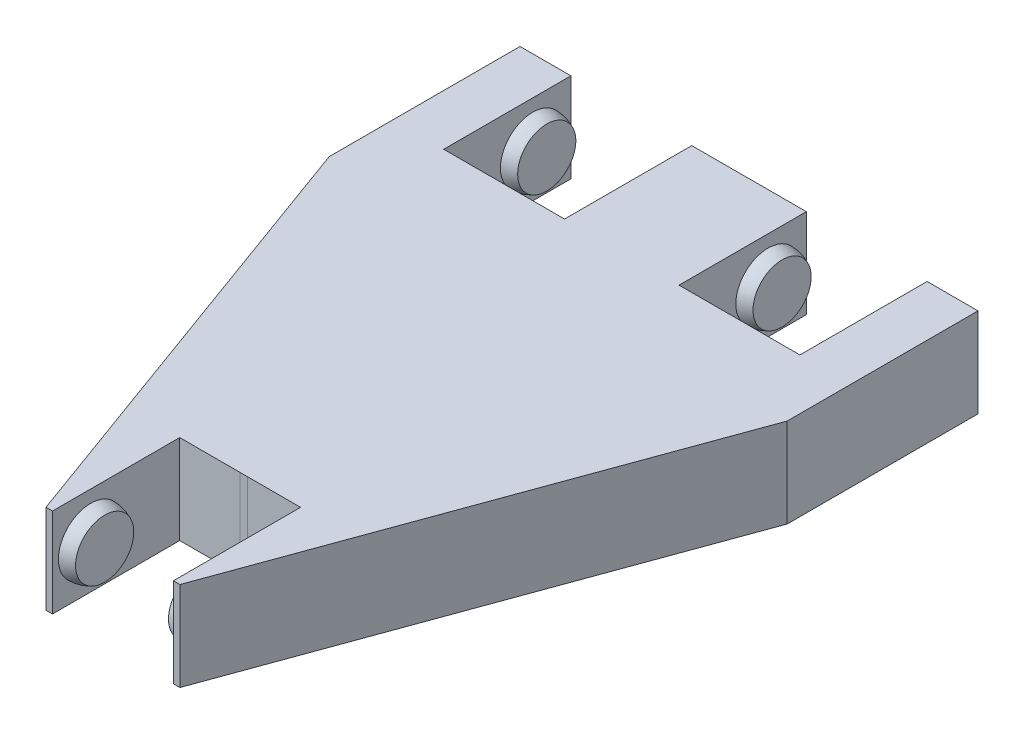
from build123d import *

# Parameters (mm, degrees)
BOSS_EXTRUDE1_DEPTH  = 14.027771651
CHAMFER1_SIZE        = 70
CHAMFER1_SIZE2       = 25.477916399
CHAMFER2_SIZE        = 70
CHAMFER2_SIZE2       = 25.477916399
REVOLVE1_ANGLE       = 180
SKETCH5_W            = 3.372425282
SKETCH5_H            = 11.999559726
CUT_EXTRUDE1_DEPTH   = 12
REVOLVE2_ANGLE       = 180
SKETCH10_W           = 9
SKETCH10_H           = 14.027771651
BOSS_EXTRUDE2_DEPTH  = 0.01
SKETCH11_W           = 1.173488445
SKETCH11_H           = 14.027771651
BOSS_EXTRUDE3_DEPTH  = 0.01
SKETCH12_W           = 3.597317039
SKETCH12_H           = 11.345384506
CUT_EXTRUDE2_DEPTH   = 12
SKETCH13_W           = 1.806847517
SKETCH13_H           = 14.027771651
BOSS_EXTRUDE4_DEPTH  = 0.01
MIRROR5_COPY_1_ANGLE = 180
MIRROR6_COPY_1_ANGLE = 180
MIRROR6_COPY_2_ANGLE = 180
SKETCH14_W           = 14.6
SKETCH14_H           = 11.534592578
CUT_EXTRUDE3_DEPTH   = 12


with BuildPart() as part:
    # Sketch1 → Boss-Extrude1 (new body)
    with BuildSketch(Plane(origin=(0, 0, 0), x_dir=(1, 0, 0), z_dir=(0, 1, 0))):
        Polygon((-28, 50), (-36, 50), (-36, -50), (-9.5, -50), (-9.5, -30), (9.5, -30), (9.5, -50), (36, -50), (36, 50), (28, 50), (28, 30), (9, 30), (9, 50), (-9, 50), (-9, 30), (-28, 30), align=None)
    extrude(amount=BOSS_EXTRUDE1_DEPTH)

    # Chamfer1
    chamfer1_edges = [part.edges().sort_by_distance(p)[0] for p in [
        (36, 7.013885825, 50),
    ]]
    chamfer1_side = [part.faces().sort_by_distance(p)[0] for p in [
        (36, 7.013885825, 0),
    ]]
    chamfer(chamfer1_edges, length=CHAMFER1_SIZE, length2=CHAMFER1_SIZE2, reference=chamfer1_side[0])

    # Chamfer2
    chamfer2_edges = [part.edges().sort_by_distance(p)[0] for p in [
        (-36, 7.013885825, 50),
    ]]
    chamfer2_side = [part.faces().sort_by_distance(p)[0] for p in [
        (-36, 7.013885825, 0),
    ]]
    chamfer(chamfer2_edges, length=CHAMFER2_SIZE, length2=CHAMFER2_SIZE2, reference=chamfer2_side[0])

    # Sketch4 → Revolve1 (revolve)
    with BuildSketch(Plane(origin=(-9.5, 0, 0), x_dir=(0, 0, -1), z_dir=(1, 0, 0))):
        with BuildLine():
            Line((-49.075, 7), (-38.925, 7))
            ThreePointArc((-38.925, 7), (-44, 12.075), (-49.075, 7))
        make_face()
    revolve1 = revolve(axis=Axis((-9.5, 7, 49.075), (0, 0, -1)), revolution_arc=REVOLVE1_ANGLE)

    # Sketch5 → Cut-Extrude1 (cut)
    with BuildSketch(Plane.XY.offset(50)):
        with Locations((-5.613787359, 7.519250292)):
            Rectangle(SKETCH5_W, SKETCH5_H)
    extrude(amount=-CUT_EXTRUDE1_DEPTH, mode=Mode.SUBTRACT)

    # Sketch8 → Revolve2 (revolve)
    with BuildSketch(Plane(origin=(-28, 0, 0), x_dir=(0, 0, -1), z_dir=(1, 0, 0))):
        with BuildLine():
            Line((38.925, 7), (49.075, 7))
            ThreePointArc((49.075, 7), (44, 12.075), (38.925, 7))
        make_face()
    revolve2 = revolve(axis=Axis((-28, 7, -38.925), (0, 0, -1)), revolution_arc=REVOLVE2_ANGLE)

    # Sketch10 → Boss-Extrude2 (add)
    with BuildSketch(Plane(origin=(0, 0, -50), x_dir=(-1, 0, 0), z_dir=(0, 0, -1))):
        with Locations((-4.5, 7.013885826)):
            Rectangle(SKETCH10_W, SKETCH10_H)
    extrude(amount=BOSS_EXTRUDE2_DEPTH)

    # Mirror2: Revolve2 across plane
    add(revolve2.mirror(Plane(origin=(0, 14.027771651, -50.01), x_dir=(0, 0, 1), z_dir=(1, 0, 0))))

    # Sketch11 → Boss-Extrude3 (add)
    with BuildSketch(Plane.XY.offset(30)):
        with Locations((0.586744223, 7.013885826)):
            Rectangle(SKETCH11_W, SKETCH11_H)
    extrude(amount=BOSS_EXTRUDE3_DEPTH)

    # Mirror4: Revolve1 across plane
    add(revolve1.mirror(Plane(origin=(0, 0, 30.01), x_dir=(0, 0, 1), z_dir=(1, 0, 0))))

    # Sketch12 → Cut-Extrude2 (cut)
    with BuildSketch(Plane.XY.offset(50)):
        with Locations((5.501341481, 7.065203355)):
            Rectangle(SKETCH12_W, SKETCH12_H)
    extrude(amount=-CUT_EXTRUDE2_DEPTH, mode=Mode.SUBTRACT)

    # Sketch13 → Boss-Extrude4 (add)
    with BuildSketch(Plane(origin=(0, 0, -30), x_dir=(-1, 0, 0), z_dir=(0, 0, -1))):
        with Locations((-17.596576242, 7.013885826)):
            Rectangle(SKETCH13_W, SKETCH13_H)
    extrude(amount=BOSS_EXTRUDE4_DEPTH)

    # Mirror5 copy 1 sketch → Mirror5 copy 1 (revolve)
    with BuildSketch(Plane(origin=(9, 0, 0), x_dir=(0, 0, -1), z_dir=(1, 0, 0))):
        with BuildLine():
            Line((38.925, 7), (49.075, 7))
            ThreePointArc((49.075, 7), (44, 12.075), (38.925, 7))
        make_face()
    revolve(axis=Axis((9, 7, -38.925), (0, 0, -1)), revolution_arc=MIRROR5_COPY_1_ANGLE)

    # Mirror6 copy 1 sketch → Mirror6 copy 1 (revolve)
    with BuildSketch(Plane(origin=(-9, 0, 0), x_dir=(0, 0, -1), z_dir=(-1, 0, 0))):
        with BuildLine():
            Line((38.925, -7), (49.075, -7))
            ThreePointArc((49.075, -7), (44, -12.075), (38.925, -7))
        make_face()
    revolve(axis=Axis((-9, 7, -38.925), (0, 0, 1)), revolution_arc=MIRROR6_COPY_1_ANGLE)

    # Mirror6 copy 2 sketch → Mirror6 copy 2 (revolve)
    with BuildSketch(Plane(origin=(28, 0, 0), x_dir=(0, 0, -1), z_dir=(-1, 0, 0))):
        with BuildLine():
            Line((38.925, -7), (49.075, -7))
            ThreePointArc((49.075, -7), (44, -12.075), (38.925, -7))
        make_face()
    revolve(axis=Axis((28, 7, -38.925), (0, 0, 1)), revolution_arc=MIRROR6_COPY_2_ANGLE)

    # Sketch14 → Cut-Extrude3 (cut)
    with BuildSketch(Plane(origin=(0, 0, -50), x_dir=(-1, 0, 0), z_dir=(0, 0, -1))):
        with Locations((-18.5, 6.982775721)):
            Rectangle(SKETCH14_W, SKETCH14_H)
        with Locations((18.5, 6.982775721)):
            Rectangle(SKETCH14_W, SKETCH14_H)
    extrude(amount=-CUT_EXTRUDE3_DEPTH, mode=Mode.SUBTRACT)


solid = part.part
